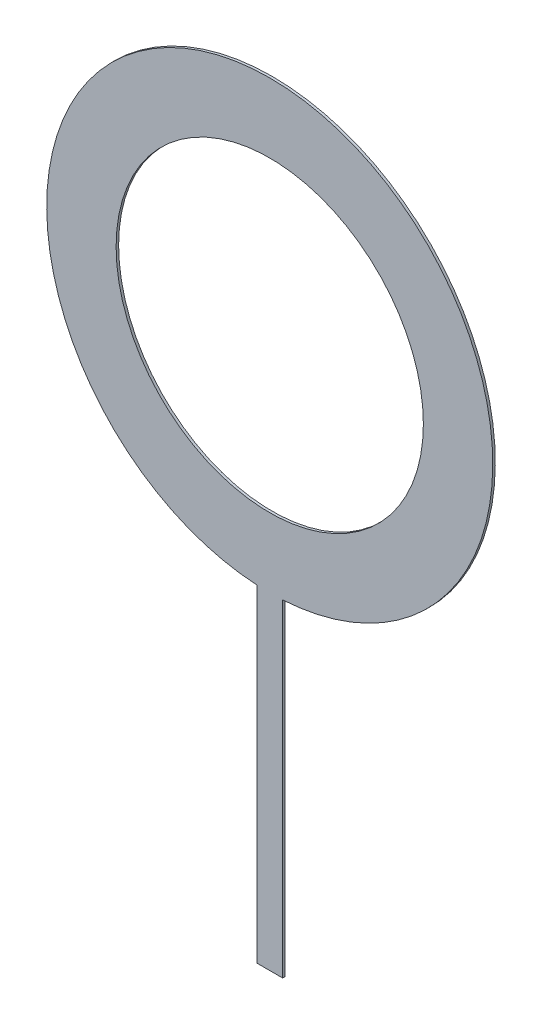
from build123d import *

# Parameters (mm, degrees)
BOSS_EXTRUDE1_DEPTH = 0.127


with BuildPart() as part:
    # Sketch1 → Boss-Extrude1 (new body)
    # profile 1 of 5: a face of its own
    with BuildSketch(Plane.XY):
        with BuildLine():
            Line((-0.65, -7.75), (0, -7.75))
            Line((0, -7.75), (0.65, -7.75))
            Line((0.65, -7.75), (0.65, -11.231206525))
            ThreePointArc((0.65, -11.231206525), (8.181534086, -7.721722606), (11.25, 0))
            ThreePointArc((11.25, 0), (-7.721722606, 8.181534086), (-0.65, -11.231206525))
            Line((-0.65, -11.231206525), (-0.65, -7.75))
        make_face()
        with BuildLine():
            ThreePointArc((7.75, 0), (5.480077554, -5.480077554), (0, -7.75))
            ThreePointArc((0, -7.75), (-5.480077554, 5.480077554), (7.75, 0))
        make_face(mode=Mode.SUBTRACT)
    # profile 2 of 5: a face of its own
    with BuildSketch(Plane.XY):
        with BuildLine():
            Line((0.65, -7.75), (0, -7.75))
            Line((0, -7.75), (0, -11.25))
            ThreePointArc((0, -11.25), (0.325135816, -11.24530065), (0.65, -11.231206525))
            Line((0.65, -11.231206525), (0.65, -7.75))
        make_face()
    # profile 3 of 5: a face of its own
    with BuildSketch(Plane.XY):
        with BuildLine():
            Line((0, -11.25), (0, -7.75))
            Line((0, -7.75), (-0.65, -7.75))
            Line((-0.65, -7.75), (-0.65, -11.231206525))
            ThreePointArc((-0.65, -11.231206525), (-0.325135816, -11.24530065), (0, -11.25))
        make_face()
    # profile 4 of 5: a face of its own
    with BuildSketch(Plane.XY):
        with BuildLine():
            Line((0, -27.75), (0, -11.25))
            ThreePointArc((0, -11.25), (-0.325135816, -11.24530065), (-0.65, -11.231206525))
            Line((-0.65, -11.231206525), (-0.65, -27.75))
            Line((-0.65, -27.75), (0, -27.75))
        make_face()
    # profile 5 of 5: a face of its own
    with BuildSketch(Plane.XY):
        with BuildLine():
            ThreePointArc((0.65, -11.231206525), (0.325135816, -11.24530065), (0, -11.25))
            Line((0, -11.25), (0, -27.75))
            Line((0, -27.75), (0.65, -27.75))
            Line((0.65, -27.75), (0.65, -11.231206525))
        make_face()
    extrude(amount=BOSS_EXTRUDE1_DEPTH)


solid = part.part
